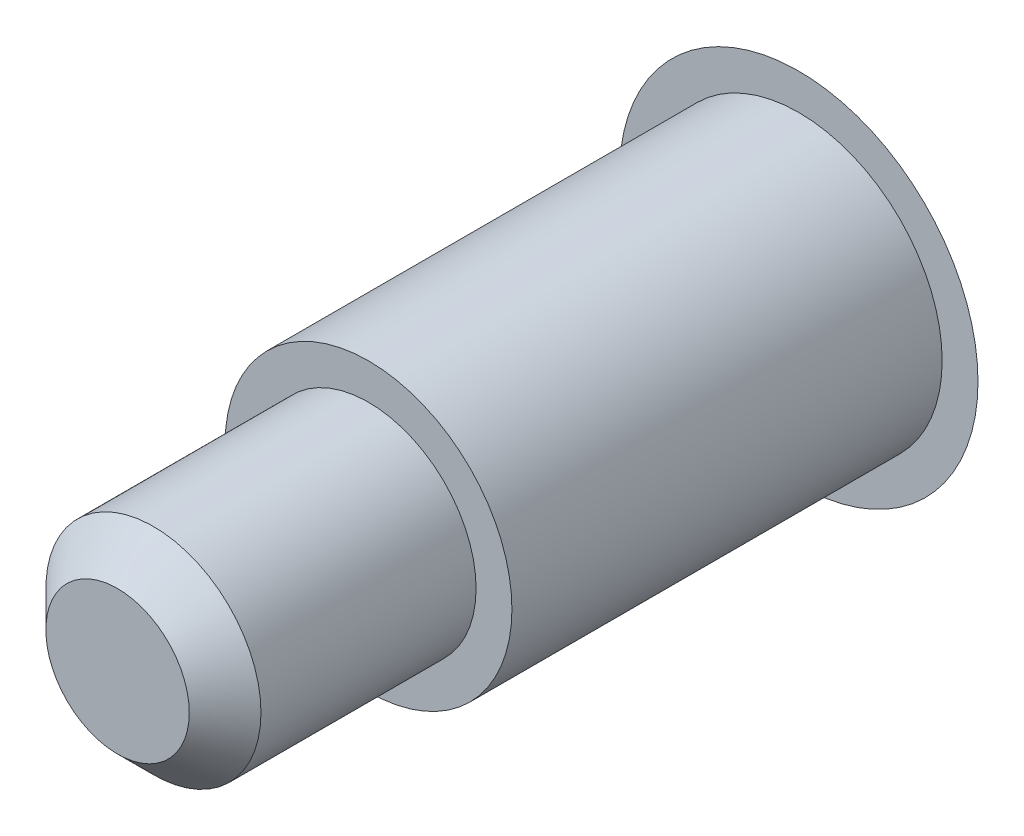
from build123d import *

# Parameters (mm, degrees)
SKETCH2_R           = 1.5
BOSS_EXTRUDE1_DEPTH = 3.5
CHAMFER1_SIZE       = 0.5


with BuildPart() as part:
    # Sketch1 → Revolve1 (revolve)
    with BuildSketch(Plane(origin=(0, 0, 0), x_dir=(1, 0, 0), z_dir=(0, 1, 0)), mode=Mode.PRIVATE) as revolve1_sk:
        with BuildLine():
            Line((0, 0), (-2, 0))
            Line((-2, 0), (-2, 6))
            Line((-2, 6), (-2.5, 6))
            ThreePointArc((-2.5, 6), (-1.530776406, 6.373105626), (-0.5, 6.5))
            Line((-0.5, 6.5), (0, 6.5))
            Line((0, 6.5), (0, 0))
        make_face()
    revolve(revolve1_sk.sketch.rotate(Axis((0, 0, 0), (0, 0, -1)), 180), axis=Axis((0, 0, 0), (0, 0, -1)))

    # Sketch2 → Boss-Extrude1 (add)
    with BuildSketch(Plane.XY):
        Circle(SKETCH2_R)
    extrude(amount=BOSS_EXTRUDE1_DEPTH)

    # Chamfer1
    chamfer1_edges = [part.edges().sort_by_distance(p)[0] for p in [
        (-1.5, 0, 3.5),
    ]]
    chamfer(chamfer1_edges, length=CHAMFER1_SIZE)


solid = part.part
